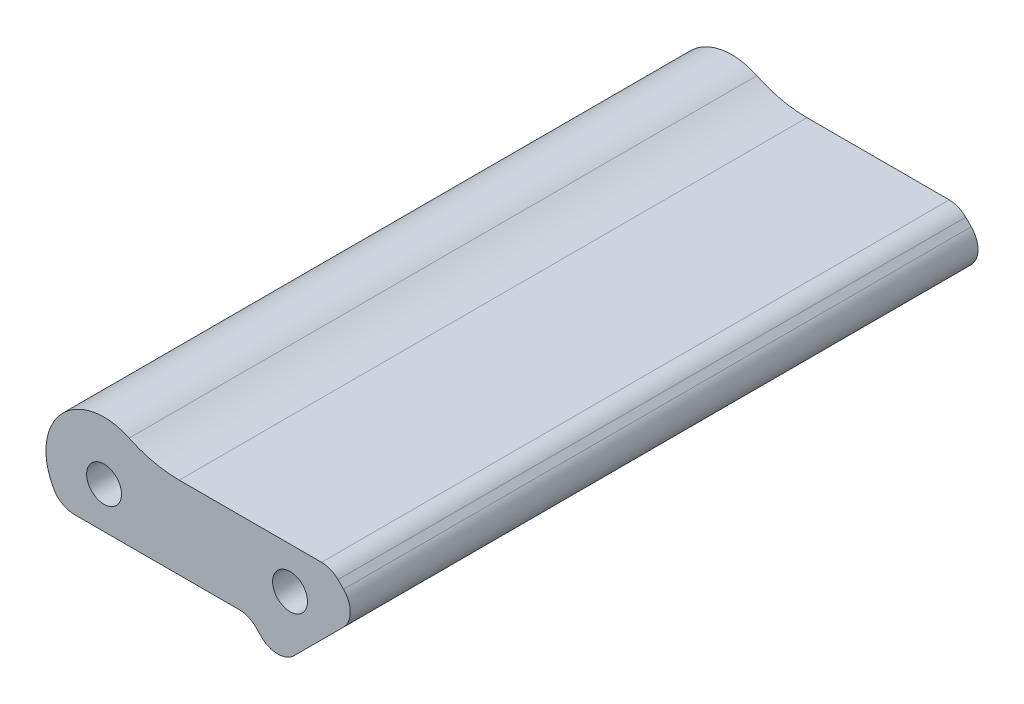
from build123d import *

# Parameters (mm, degrees)
SKETCH_1_R      = 1.5
EXTRUDE_1_DEPTH = 54


with BuildPart() as part:
    # 草图1 → 凸台-拉伸1 (new body)
    with BuildSketch(Plane.XY):
        with BuildLine():
            Line((-10.577234103, -3.535533906), (3.636038969, -3.535533906))
            ThreePointArc((3.636038969, -3.535533906), (4.401405834, -3.687774841), (5.050252532, -4.121320344))
            Line((5.050252532, -4.121320344), (5.525126266, -4.596194078))
            ThreePointArc((5.525126266, -4.596194078), (6.939339828, -5.181980515), (8.353553391, -4.596194078))
            Line((8.353553391, -4.596194078), (12.596194078, -0.353553391))
            ThreePointArc((12.596194078, -0.353553391), (13.181980515, 1.060660172), (12.596194078, 2.474873734))
            Line((12.596194078, 2.474873734), (12.121320344, 2.949747468))
            ThreePointArc((12.121320344, 2.949747468), (11.472473646, 3.383292971), (10.707106781, 3.535533906))
            Line((10.707106781, 3.535533906), (-1.535533906, 3.535533906))
            ThreePointArc((-1.535533906, 3.535533906), (-3.744957733, 3.782665284), (-5.845177969, 4.511844635))
            ThreePointArc((-5.845177969, 4.511844635), (-11.693982673, 3.369642712), (-12.295390172, -2.559223177))
            ThreePointArc((-12.295390172, -2.559223177), (-11.565318477, -3.27440977), (-10.577234103, -3.535533906))
        make_face()
        with Locations((-8, 0)):
            Circle(SKETCH_1_R, mode=Mode.SUBTRACT)
        with Locations((8, 0)):
            Circle(SKETCH_1_R, mode=Mode.SUBTRACT)
    extrude(amount=EXTRUDE_1_DEPTH)


solid = part.part
